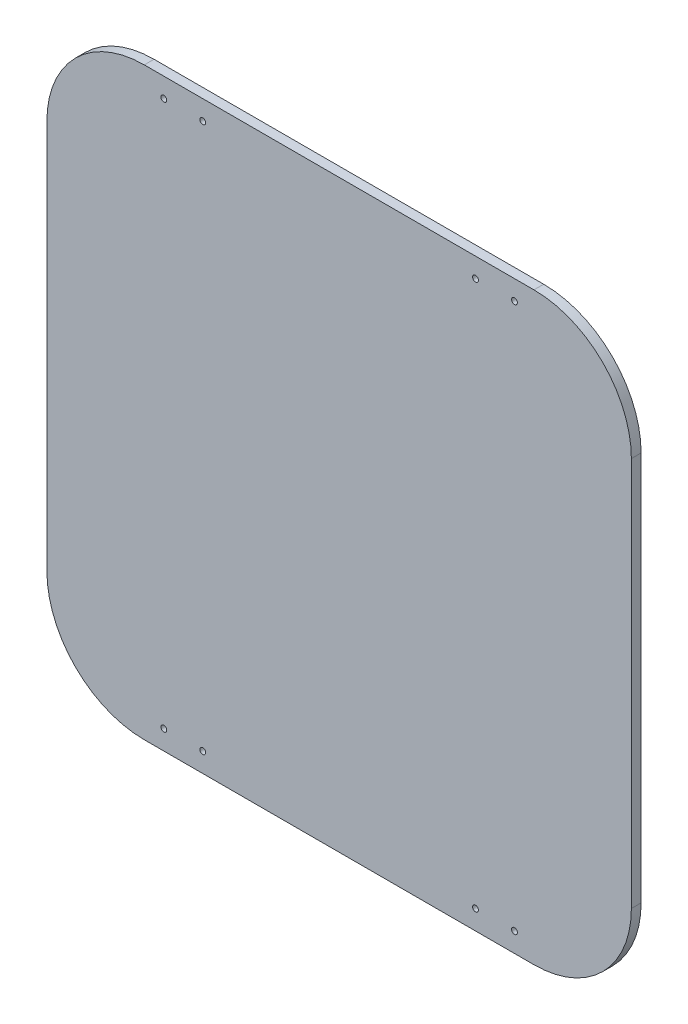
from build123d import *

# Parameters (mm, degrees)
SKETCH1_R           = 1.5
BOSS_EXTRUDE1_DEPTH = 5


with BuildPart() as part:
    # Sketch1 → Boss-Extrude1 (new body)
    with BuildSketch(Plane.XY):
        with BuildLine():
            Line((-100, -150), (100, -150))
            ThreePointArc((100, -150), (135.355339059, -135.355339059), (150, -100))
            Line((150, -100), (150, 100))
            ThreePointArc((150, 100), (135.355339059, 135.355339059), (100, 150))
            Line((100, 150), (-100, 150))
            ThreePointArc((-100, 150), (-135.355339059, 135.355339059), (-150, 100))
            Line((-150, 100), (-150, -100))
            ThreePointArc((-150, -100), (-135.355339059, -135.355339059), (-100, -150))
        make_face()
        with Locations((-70, 140)):
            Circle(SKETCH1_R, mode=Mode.SUBTRACT)
        with Locations((-90, 140)):
            Circle(SKETCH1_R, mode=Mode.SUBTRACT)
        with Locations((70, 140)):
            Circle(SKETCH1_R, mode=Mode.SUBTRACT)
        with Locations((90, -140)):
            Circle(SKETCH1_R, mode=Mode.SUBTRACT)
        with Locations((70, -140)):
            Circle(SKETCH1_R, mode=Mode.SUBTRACT)
        with Locations((-70, -140)):
            Circle(SKETCH1_R, mode=Mode.SUBTRACT)
        with Locations((-90, -140)):
            Circle(SKETCH1_R, mode=Mode.SUBTRACT)
        with Locations((90, 140)):
            Circle(SKETCH1_R, mode=Mode.SUBTRACT)
    extrude(amount=BOSS_EXTRUDE1_DEPTH)


solid = part.part
